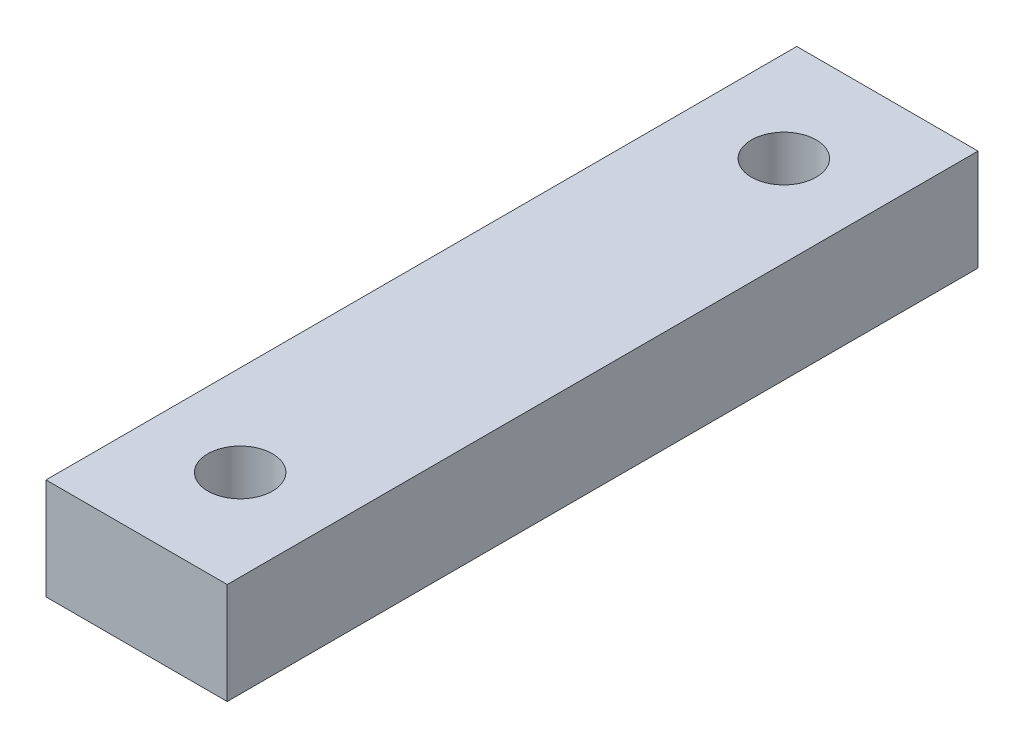
from build123d import *

# Parameters (mm, degrees)
SKETCH1_W           = 14
SKETCH1_H           = 58
SKETCH1_R           = 2.5
BOSS_EXTRUDE1_DEPTH = 7.83


with BuildPart() as part:
    # Sketch1 → Boss-Extrude1 (new body)
    with BuildSketch(Plane(origin=(0, 0, 0), x_dir=(1, 0, 0), z_dir=(0, 1, 0))):
        with Locations((7, 29)):
            Rectangle(SKETCH1_W, SKETCH1_H)
        with Locations(Location((7, 50, 0), (0, 0, 270))):
            Circle(SKETCH1_R, mode=Mode.SUBTRACT)
        with Locations(Location((7, 8, 0), (0, 0, 270))):
            Circle(SKETCH1_R, mode=Mode.SUBTRACT)
    extrude(amount=BOSS_EXTRUDE1_DEPTH)


solid = part.part
